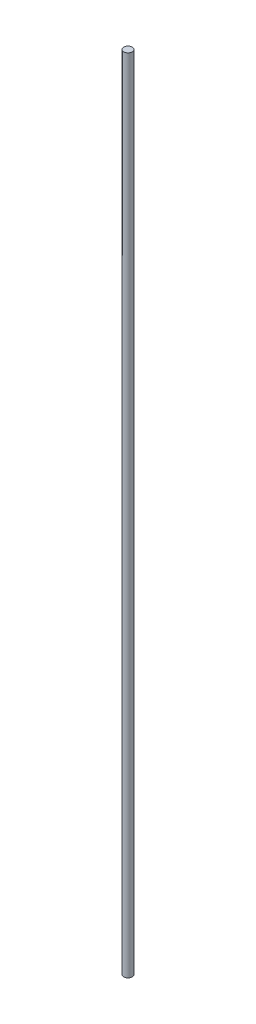
from build123d import *

# Parameters (mm, degrees)
SKETCH2_R           = 1.5
BOSS_EXTRUDE1_DEPTH = 285


with BuildPart() as part:
    # Sketch2 → Boss-Extrude1 (new body)
    with BuildSketch(Plane(origin=(0, 0, 0), x_dir=(1, 0, 0), z_dir=(0, 1, 0))):
        with Locations(Location((0, 0, 0), (0, 0, 270))):
            Circle(SKETCH2_R)
    extrude(amount=BOSS_EXTRUDE1_DEPTH)


solid = part.part
